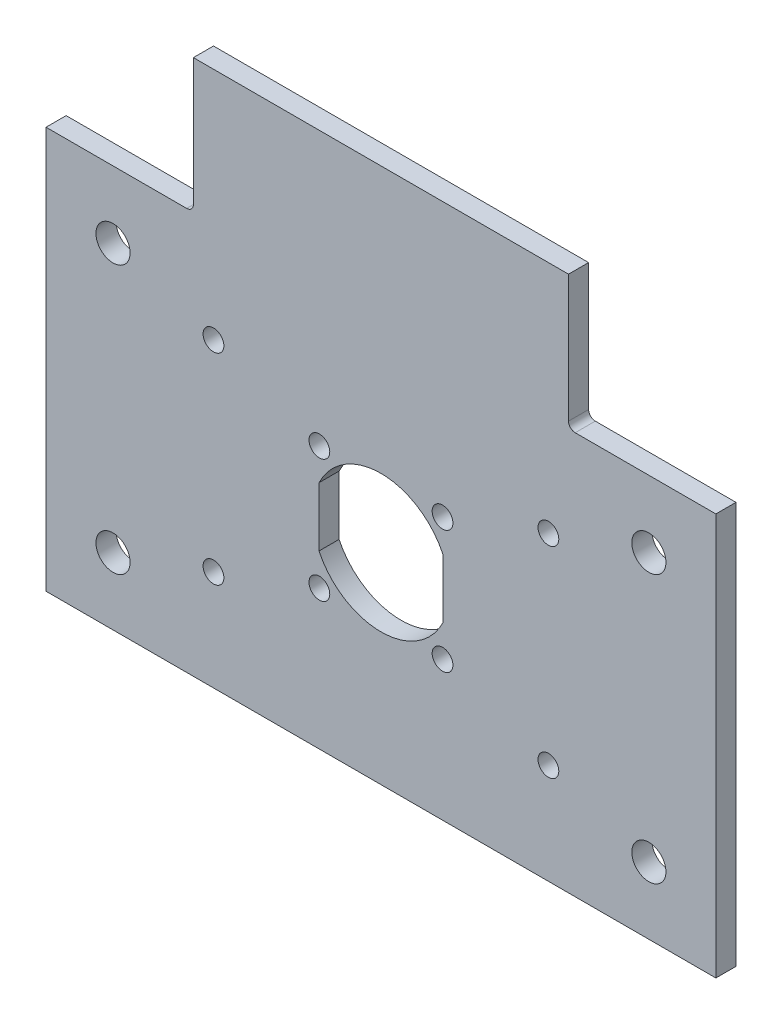
from build123d import *

# Parameters (mm, degrees)
EXTRUDE_1_DEPTH     = 3
SKETCH_2_R          = 1.55
CUT_EXTRUDE_1_DEPTH = 95.387499172
FILLET_1_R          = 1
SKETCH_3_R          = 2.55
CUT_EXTRUDE_2_DEPTH = 95.387499172
SKETCH_4_R          = 1.55
CUT_EXTRUDE_3_DEPTH = 95.387499172


with BuildPart() as part:
    # ｽｹｯﾁ1 → ﾎﾞｽ - 押し出し1 (new body)
    with BuildSketch(Plane.XY):
        Polygon((-28, 80), (-28, 60), (-50, 60), (-50, 0), (50, 0), (50, 60), (28, 60), (28, 80), align=None)
        with BuildLine():
            Line((-9.25, 34.415880433), (-9.25, 25.584119567))
            ThreePointArc((-9.25, 25.584119567), (0, 19.75), (9.25, 25.584119567))
            Line((9.25, 25.584119567), (9.25, 34.415880433))
            ThreePointArc((9.25, 34.415880433), (0, 40.25), (-9.25, 34.415880433))
        make_face(mode=Mode.SUBTRACT)
    extrude(amount=EXTRUDE_1_DEPTH)

    # ｽｹｯﾁ2 → ｶｯﾄ - 押し出し1 (cut, through all)
    with BuildSketch(Plane.XY.offset(3)):
        with Locations((-9.192388155, 39.192388155)):
            Circle(SKETCH_2_R)
        with Locations((9.192388155, 39.192388155)):
            Circle(SKETCH_2_R)
        with Locations((9.192388155, 20.807611845)):
            Circle(SKETCH_2_R)
        with Locations((-9.192388155, 20.807611845)):
            Circle(SKETCH_2_R)
    extrude(amount=-CUT_EXTRUDE_1_DEPTH, mode=Mode.SUBTRACT)

    # ﾌｨﾚｯﾄ1
    fillet_1_edges = [part.edges().sort_by_distance(p)[0] for p in [
        (28, 60, 1.5),
        (-28, 60, 1.5),
    ]]
    fillet(fillet_1_edges, radius=FILLET_1_R)

    # ｽｹｯﾁ3 → ｶｯﾄ - 押し出し2 (cut, through all)
    with BuildSketch(Plane.XY.offset(3)):
        with Locations((-40, 50)):
            Circle(SKETCH_3_R)
        with Locations(Location((-40, 10, 0), (0, 0, 180))):
            Circle(SKETCH_3_R)
        with Locations((40, 10)):
            Circle(SKETCH_3_R)
        with Locations(Location((40, 50, 0), (0, 0, 180))):
            Circle(SKETCH_3_R)
    extrude(amount=-CUT_EXTRUDE_2_DEPTH, mode=Mode.SUBTRACT)

    # ｽｹｯﾁ4 → ｶｯﾄ - 押し出し3 (cut, through all)
    with BuildSketch(Plane.XY.offset(3)):
        with Locations((25, 45)):
            Circle(SKETCH_4_R)
        with Locations((25, 15)):
            Circle(SKETCH_4_R)
        with Locations((-25, 15)):
            Circle(SKETCH_4_R)
        with Locations((-25, 45)):
            Circle(SKETCH_4_R)
    extrude(amount=-CUT_EXTRUDE_3_DEPTH, mode=Mode.SUBTRACT)


solid = part.part
